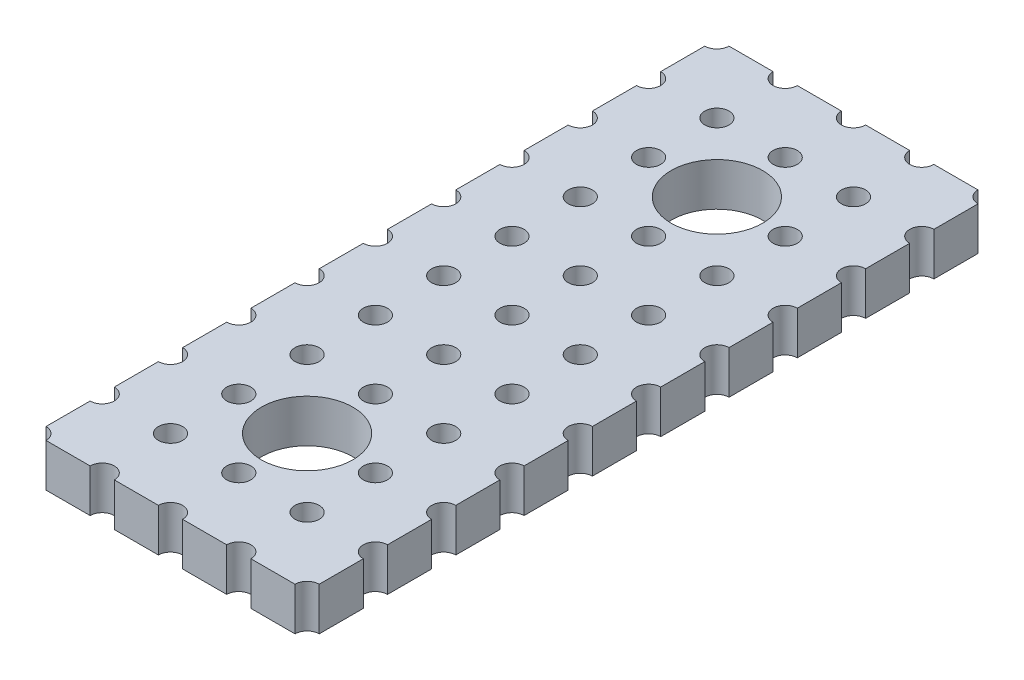
from build123d import *

# Parameters (mm, degrees)
ESQUISSE1_W             = 10.16
ESQUISSE1_H             = 25.4
BOSS_EXTRU_1_DEPTH      = 1.6
ESQUISSE2_R             = 0.45
ENL_V_MAT_EXTRU_1_DEPTH = 23.808828305
D_GAGEMENT_M31_D        = 3.4


with BuildPart() as part:
    # Esquisse1 → Boss.-Extru.1 (new body)
    with BuildSketch(Plane(origin=(0, 0, 0), x_dir=(1, 0, 0), z_dir=(0, 1, 0))):
        with Locations((1.195294118, -9.170147059)):
            Rectangle(ESQUISSE1_W, ESQUISSE1_H)
    extrude(amount=BOSS_EXTRU_1_DEPTH)

    # Esquisse2 → Enlèv. mat.-Extru.1 (cut, through all)
    with BuildSketch(Plane(origin=(0, 1.6, 0), x_dir=(1, 0, 0), z_dir=(0, 1, 0))):
        with Locations((-3.884705882, 3.529852941)):
            Circle(ESQUISSE2_R)
        with Locations((-1.344705882, 3.529852941)):
            Circle(ESQUISSE2_R)
        with Locations((1.195294118, 3.529852941)):
            Circle(ESQUISSE2_R)
        with Locations((3.735294118, 3.529852941)):
            Circle(ESQUISSE2_R)
        with Locations(Location((-1.344705882, 0.989852941, 0), (0, 0, 270))):
            Circle(ESQUISSE2_R)
        with Locations(Location((1.195294118, 0.989852941, 0), (0, 0, 270))):
            Circle(ESQUISSE2_R)
        with Locations(Location((3.735294118, 0.989852941, 0), (0, 0, 270))):
            Circle(ESQUISSE2_R)
        with Locations(Location((-1.344705882, -1.550147059, 0), (0, 0, 270))):
            Circle(ESQUISSE2_R)
        with Locations(Location((1.195294118, -1.550147059, 0), (0, 0, 270))):
            Circle(ESQUISSE2_R)
        with Locations(Location((3.735294118, -1.550147059, 0), (0, 0, 270))):
            Circle(ESQUISSE2_R)
        with Locations(Location((-1.344705882, -4.090147059, 0), (0, 0, 270))):
            Circle(ESQUISSE2_R)
        with Locations(Location((1.195294118, -4.090147059, 0), (0, 0, 270))):
            Circle(ESQUISSE2_R)
        with Locations(Location((3.735294118, -4.090147059, 0), (0, 0, 270))):
            Circle(ESQUISSE2_R)
        with Locations(Location((-1.344705882, -6.630147059, 0), (0, 0, 270))):
            Circle(ESQUISSE2_R)
        with Locations(Location((1.195294118, -6.630147059, 0), (0, 0, 270))):
            Circle(ESQUISSE2_R)
        with Locations(Location((3.735294118, -6.630147059, 0), (0, 0, 270))):
            Circle(ESQUISSE2_R)
        with Locations(Location((-1.344705882, -9.170147059, 0), (0, 0, 270))):
            Circle(ESQUISSE2_R)
        with Locations(Location((1.195294118, -9.170147059, 0), (0, 0, 270))):
            Circle(ESQUISSE2_R)
        with Locations(Location((3.735294118, -9.170147059, 0), (0, 0, 270))):
            Circle(ESQUISSE2_R)
        with Locations(Location((-1.344705882, -11.710147059, 0), (0, 0, 270))):
            Circle(ESQUISSE2_R)
        with Locations(Location((1.195294118, -11.710147059, 0), (0, 0, 270))):
            Circle(ESQUISSE2_R)
        with Locations(Location((3.735294118, -11.710147059, 0), (0, 0, 270))):
            Circle(ESQUISSE2_R)
        with Locations(Location((-1.344705882, -14.250147059, 0), (0, 0, 270))):
            Circle(ESQUISSE2_R)
        with Locations(Location((1.195294118, -14.250147059, 0), (0, 0, 270))):
            Circle(ESQUISSE2_R)
        with Locations(Location((3.735294118, -14.250147059, 0), (0, 0, 270))):
            Circle(ESQUISSE2_R)
        with Locations((-3.884705882, 0.989852941)):
            Circle(ESQUISSE2_R)
        with Locations((-3.884705882, -1.550147059)):
            Circle(ESQUISSE2_R)
        with Locations((-3.884705882, -4.090147059)):
            Circle(ESQUISSE2_R)
        with Locations((-3.884705882, -6.630147059)):
            Circle(ESQUISSE2_R)
        with Locations((-3.884705882, -9.170147059)):
            Circle(ESQUISSE2_R)
        with Locations((-3.884705882, -11.710147059)):
            Circle(ESQUISSE2_R)
        with Locations((-3.884705882, -14.250147059)):
            Circle(ESQUISSE2_R)
        with Locations((6.275294118, 3.529852941)):
            Circle(ESQUISSE2_R)
        with Locations((6.275294118, 0.989852941)):
            Circle(ESQUISSE2_R)
        with Locations((6.275294118, -1.550147059)):
            Circle(ESQUISSE2_R)
        with Locations((6.275294118, -4.090147059)):
            Circle(ESQUISSE2_R)
        with Locations((6.275294118, -6.630147059)):
            Circle(ESQUISSE2_R)
        with Locations((6.275294118, -9.170147059)):
            Circle(ESQUISSE2_R)
        with Locations((6.275294118, -11.710147059)):
            Circle(ESQUISSE2_R)
        with Locations((6.275294118, -14.250147059)):
            Circle(ESQUISSE2_R)
        with Locations((-3.884705882, -16.790147059)):
            Circle(ESQUISSE2_R)
        with Locations(Location((-1.344705882, -16.790147059, 0), (0, 0, 270))):
            Circle(ESQUISSE2_R)
        with Locations(Location((1.195294118, -16.790147059, 0), (0, 0, 270))):
            Circle(ESQUISSE2_R)
        with Locations(Location((3.735294118, -16.790147059, 0), (0, 0, 270))):
            Circle(ESQUISSE2_R)
        with Locations((6.275294118, -16.790147059)):
            Circle(ESQUISSE2_R)
        with Locations((-3.884705882, -19.330147059)):
            Circle(ESQUISSE2_R)
        with Locations(Location((-1.344705882, -19.330147059, 0), (0, 0, 270))):
            Circle(ESQUISSE2_R)
        with Locations(Location((1.195294118, -19.330147059, 0), (0, 0, 270))):
            Circle(ESQUISSE2_R)
        with Locations(Location((3.735294118, -19.330147059, 0), (0, 0, 270))):
            Circle(ESQUISSE2_R)
        with Locations((6.275294118, -19.330147059)):
            Circle(ESQUISSE2_R)
        with Locations((-3.884705882, -21.870147059)):
            Circle(ESQUISSE2_R)
        with Locations((-1.344705882, -21.870147059)):
            Circle(ESQUISSE2_R)
        with Locations((1.195294118, -21.870147059)):
            Circle(ESQUISSE2_R)
        with Locations((3.735294118, -21.870147059)):
            Circle(ESQUISSE2_R)
        with Locations((6.275294118, -21.870147059)):
            Circle(ESQUISSE2_R)
    extrude(amount=-ENL_V_MAT_EXTRU_1_DEPTH, mode=Mode.SUBTRACT)

    # Dégagement M31 (through all)
    with Locations(Plane(origin=(0, 1.6, 0), x_dir=(1, 0, 0), z_dir=(0, 1, 0))):
        with Locations((1.195294118, -16.790147059), (1.195294118, -1.550147059)):
            Hole(D_GAGEMENT_M31_D / 2)


solid = part.part
